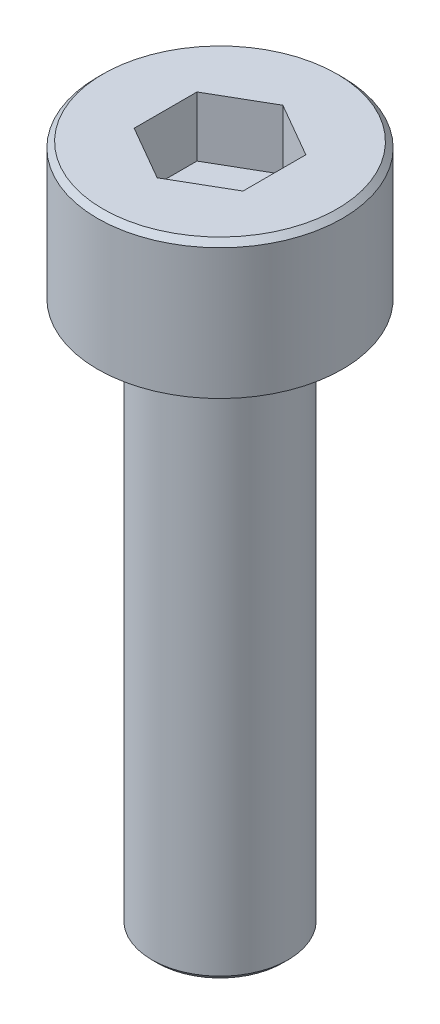
from build123d import *

# Parameters (mm, degrees)
SMUSSO1_SIZE             = 0.1
TAGLIO_ESTRUSIONE1_DEPTH = 1.1


with BuildPart() as part:
    # Schizzo1 → Rivoluzione1 (revolve)
    with BuildSketch(Plane.XY, mode=Mode.PRIVATE) as rivoluzione1_sk:
        Polygon((0, 0), (0, 2.5), (2.25, 2.5), (2.25, 0), (1.25, 0), (1.25, -10), (0, -10), align=None)
    revolve(rivoluzione1_sk.sketch.rotate(Axis((0, 28.388481997, 0), (0, -1, 0)), 90), axis=Axis((0, 28.388481997, 0), (0, -1, 0)))

    # Smusso1
    smusso1_edges = [part.edges().sort_by_distance(p)[0] for p in [
        (0, -10, -1.25),
        (0, 2.5, -2.25),
    ]]
    chamfer(smusso1_edges, length=SMUSSO1_SIZE)

    # Schizzo2 → Taglio-Estrusione1 (cut)
    with BuildSketch(Plane(origin=(0, 2.5, 0), x_dir=(1, 0, 0), z_dir=(0, 1, 0))):
        Polygon((0, 1.154700538), (-1, 0.577350269), (-1, -0.577350269), (0, -1.154700538), (1, -0.577350269), (1, 0.577350269), align=None)
    extrude(amount=-TAGLIO_ESTRUSIONE1_DEPTH, mode=Mode.SUBTRACT)


solid = part.part
